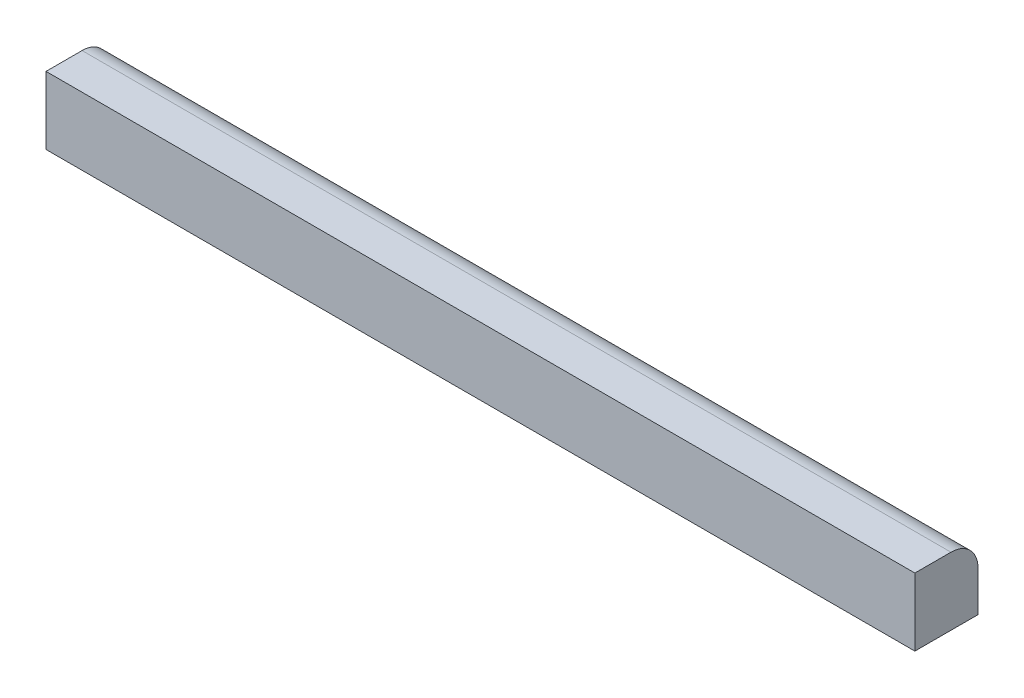
from build123d import *

# Parameters (mm, degrees)
SKETCH_1_W      = 289
SKETCH_1_H      = 22.5
EXTRUDE_1_DEPTH = 21
FILLET_1_R      = 9


with BuildPart() as part:
    # 草图1 → 凸台-拉伸1 (new body)
    with BuildSketch(Plane.XY):
        Rectangle(SKETCH_1_W, SKETCH_1_H)
    extrude(amount=EXTRUDE_1_DEPTH)

    # 圆角1
    fillet_1_edges = [part.edges().sort_by_distance(p)[0] for p in [
        (0, 11.25, 0),
    ]]
    fillet(fillet_1_edges, radius=FILLET_1_R)


solid = part.part
